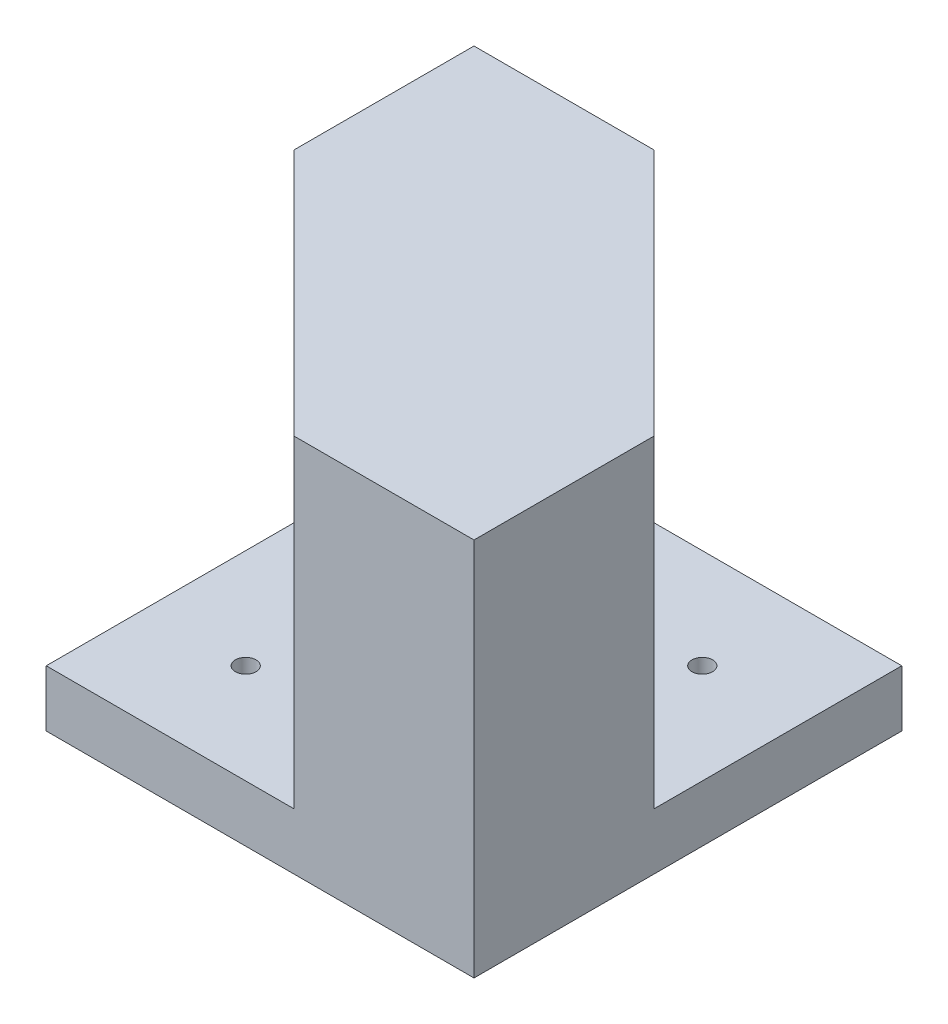
from build123d import *

# Parameters (mm, degrees)
SKETCH1_W           = 67.31
SKETCH1_H           = 67.31
SKETCH1_R           = 1.625
BOSS_EXTRUDE1_DEPTH = 8.89
BOSS_EXTRUDE2_DEPTH = 50.8
SKETCH3_R           = 2
CUT_EXTRUDE2_DEPTH  = 127


with BuildPart() as part:
    # Sketch1 → Boss-Extrude1 (new body)
    with BuildSketch(Plane(origin=(0, 0, 0), x_dir=(1, 0, 0), z_dir=(0, 1, 0))):
        Rectangle(SKETCH1_W, SKETCH1_H)
        with Locations(Location((17.960512242, 17.960512242, 0), (0, 0, 270))):
            Circle(SKETCH1_R, mode=Mode.SUBTRACT)
        with Locations(Location((-17.960512242, -17.960512242, 0), (0, 0, 270))):
            Circle(SKETCH1_R, mode=Mode.SUBTRACT)
    extrude(amount=BOSS_EXTRUDE1_DEPTH)

    # Sketch2 → Boss-Extrude2 (add)
    with BuildSketch(Plane(origin=(0, 8.89, 0), x_dir=(1, 0, 0), z_dir=(0, 1, 0))):
        Polygon((17.943087322, -33.655), (-33.655, 17.943087322), (-33.655, 5.370728753), (5.370728753, -33.655), align=None)
        Polygon((33.655, -17.943087322), (-17.943087322, 33.655), (-33.655, 33.655), (-33.655, 17.943087322), (17.943087322, -33.655), (33.655, -33.655), align=None)
        Polygon((-5.370728753, 33.655), (-17.943087322, 33.655), (33.655, -17.943087322), (33.655, -5.370728753), align=None)
    extrude(amount=BOSS_EXTRUDE2_DEPTH)

    # Sketch3 → Cut-Extrude2 (cut)
    with BuildSketch(Plane(origin=(-14.142135624, 0, 14.142135624), x_dir=(0.7071067811865464, 0, 0.7071067811865488), z_dir=(-0.7071067811865488, 0, 0.7071067811865464))):
        with Locations((-17.960512242, 52.250512242)):
            Circle(SKETCH3_R)
        with Locations((17.960512242, 16.329487758)):
            Circle(SKETCH3_R)
        with Locations((0, 34.29)):
            Circle(SKETCH3_R)
        with Locations((17.960512242, 52.250512242)):
            Circle(SKETCH3_R)
        with Locations((-17.960512242, 16.329487758)):
            Circle(SKETCH3_R)
    extrude(amount=-CUT_EXTRUDE2_DEPTH, mode=Mode.SUBTRACT)


solid = part.part
